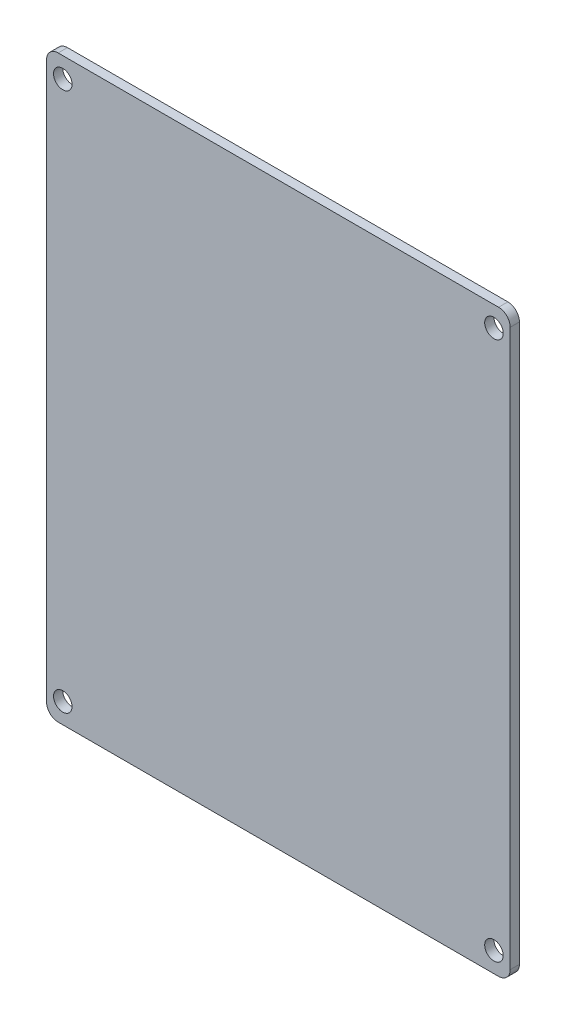
from build123d import *

# Parameters (mm, degrees)
SKETCH_1_W      = 80
SKETCH_1_H      = 100
SKETCH_1_R      = 1.6
EXTRUDE_1_DEPTH = 1.6
FILLET_1_R      = 2


with BuildPart() as part:
    # 草图1 → 凸台-拉伸1 (new body)
    with BuildSketch(Plane.XY):
        Rectangle(SKETCH_1_W, SKETCH_1_H)
        with Locations((-37.2, 46.5)):
            Circle(SKETCH_1_R, mode=Mode.SUBTRACT)
        with Locations(Location((37.2, 46.5, 0), (0, 0, 180))):
            Circle(SKETCH_1_R, mode=Mode.SUBTRACT)
        with Locations((37.2, -46.5)):
            Circle(SKETCH_1_R, mode=Mode.SUBTRACT)
        with Locations(Location((-37.2, -46.5, 0), (0, 0, 180))):
            Circle(SKETCH_1_R, mode=Mode.SUBTRACT)
    extrude(amount=EXTRUDE_1_DEPTH)

    # 圆角1
    fillet_1_edges = [part.edges().sort_by_distance(p)[0] for p in [
        (40, -50, 0.8),
        (-40, -50, 0.8),
        (-40, 50, 0.8),
        (40, 50, 0.8),
    ]]
    fillet(fillet_1_edges, radius=FILLET_1_R)


solid = part.part
